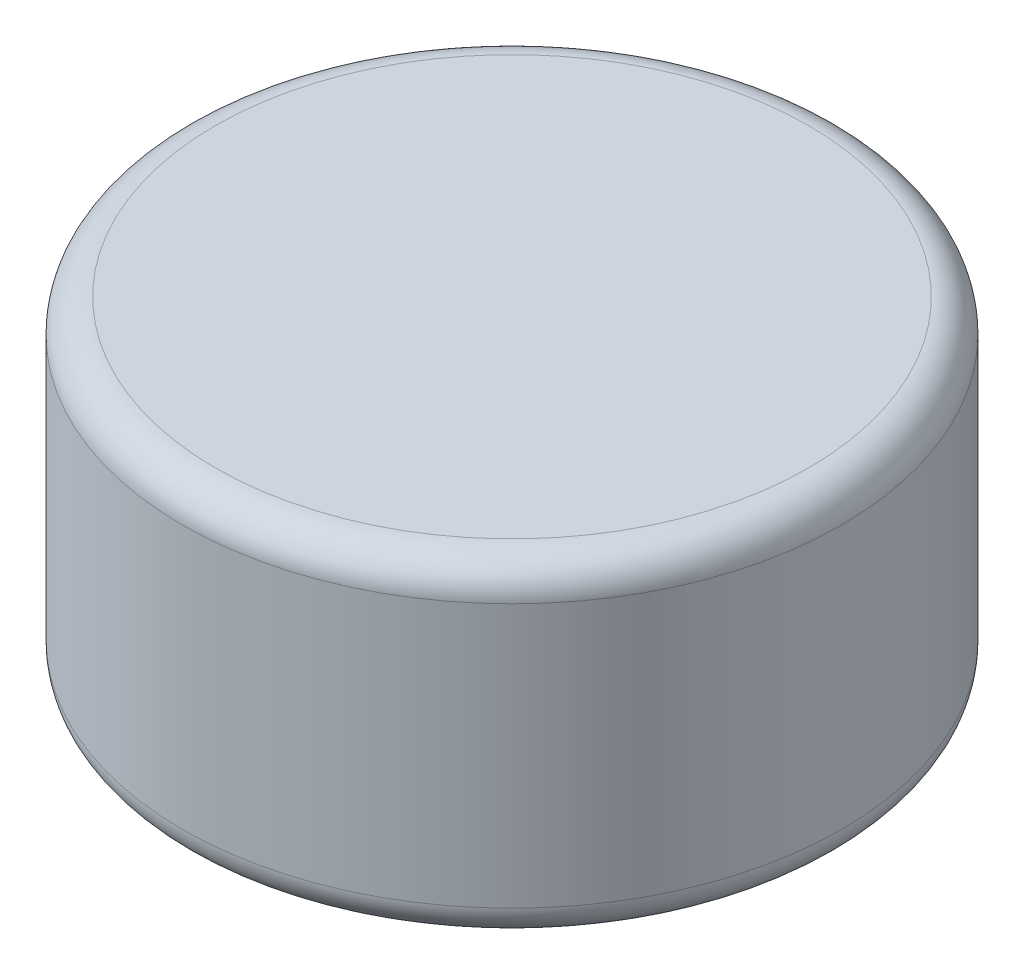
from build123d import *

# Parameters (mm, degrees)
SKETCH1_R           = 2
BOSS_EXTRUDE1_DEPTH = 2
FILLET1_R           = 0.2


with BuildPart() as part:
    # Sketch1 → Boss-Extrude1 (new body)
    with BuildSketch(Plane(origin=(0, 0, 0), x_dir=(1, 0, 0), z_dir=(0, 1, 0))):
        with Locations(Location((0, 0, 0), (0, 0, 270))):
            Circle(SKETCH1_R)
    extrude(amount=BOSS_EXTRUDE1_DEPTH)

    # Fillet1
    fillet1_edges = [part.edges().sort_by_distance(p)[0] for p in [
        (0, 0, -2),
        (0, 2, -2),
    ]]
    fillet(fillet1_edges, radius=FILLET1_R)


solid = part.part
